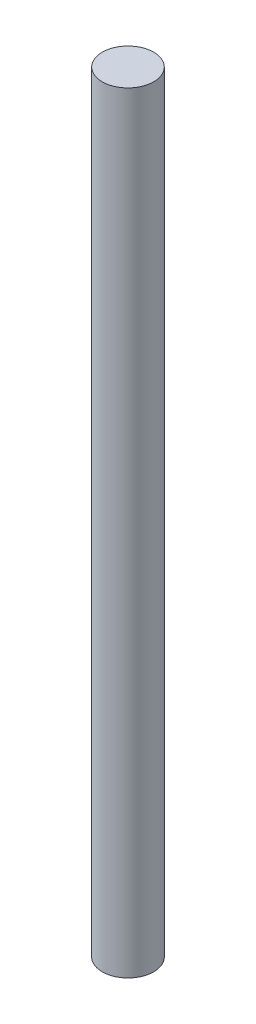
from build123d import *

# Parameters (mm, degrees)
SKETCH_1_R      = 5
EXTRUDE_1_DEPTH = 150


with BuildPart() as part:
    # Эскиз1 → Бобышка-Вытянуть1 (new body)
    with BuildSketch(Plane(origin=(0, 0, 0), x_dir=(1, 0, 0), z_dir=(0, 1, 0))):
        with Locations(Location((0, 0, 0), (0, 0, 270))):
            Circle(SKETCH_1_R)
    extrude(amount=EXTRUDE_1_DEPTH)


solid = part.part
